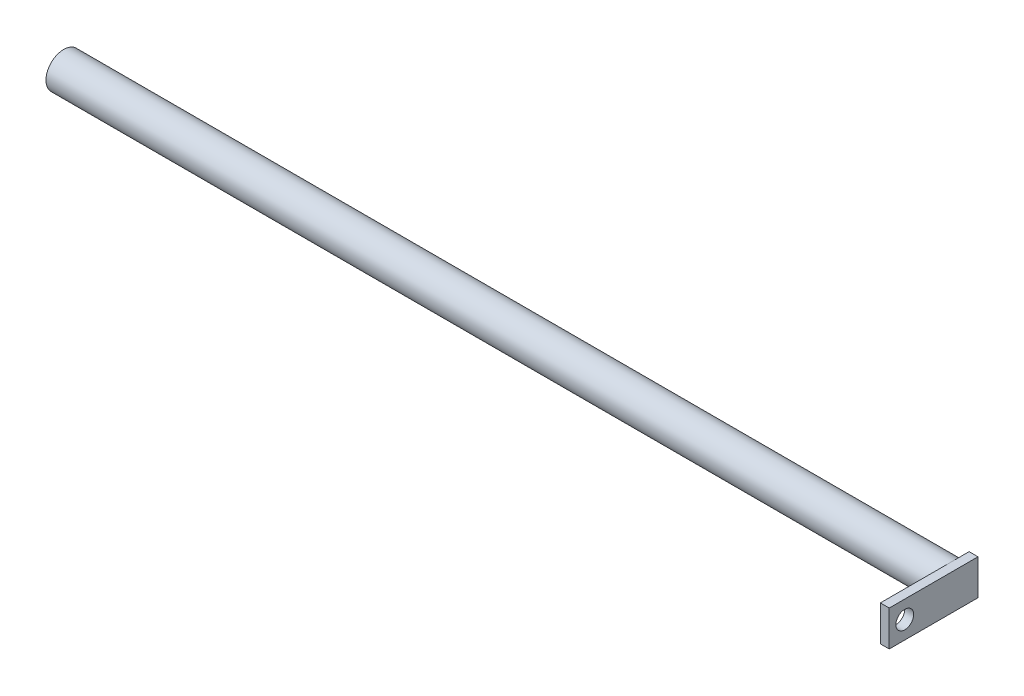
from build123d import *

# Parameters (mm, degrees)
SKETCH2_W           = 400
SKETCH2_H           = 8
SKETCH3_W           = 16
SKETCH3_H           = 40
BOSS_EXTRUDE1_DEPTH = 4
SKETCH5_R           = 4
CUT_EXTRUDE1_DEPTH  = 4


with BuildPart() as part:
    # Sketch2 → Revolve1 (revolve)
    with BuildSketch(Plane(origin=(0, 0, 0), x_dir=(-1, 0, 0), z_dir=(0, 1, 0))):
        with Locations((0, -4)):
            Rectangle(SKETCH2_W, SKETCH2_H)
    revolve(axis=Axis((200, 0, 0), (-1, 0, 0)))

    # Sketch3 → Boss-Extrude1 (add)
    with BuildSketch(Plane.YZ.offset(200)):
        with Locations((0, 12)):
            Rectangle(SKETCH3_W, SKETCH3_H)
    extrude(amount=BOSS_EXTRUDE1_DEPTH)

    # Sketch5 → Cut-Extrude1 (cut)
    with BuildSketch(Plane(origin=(200, 0, 0), x_dir=(0, -1, 0), z_dir=(-1, 0, 0))):
        with Locations(Location((0, 25, 0), (0, 0, 90))):
            Circle(SKETCH5_R)
    extrude(amount=-CUT_EXTRUDE1_DEPTH, mode=Mode.SUBTRACT)


solid = part.part
